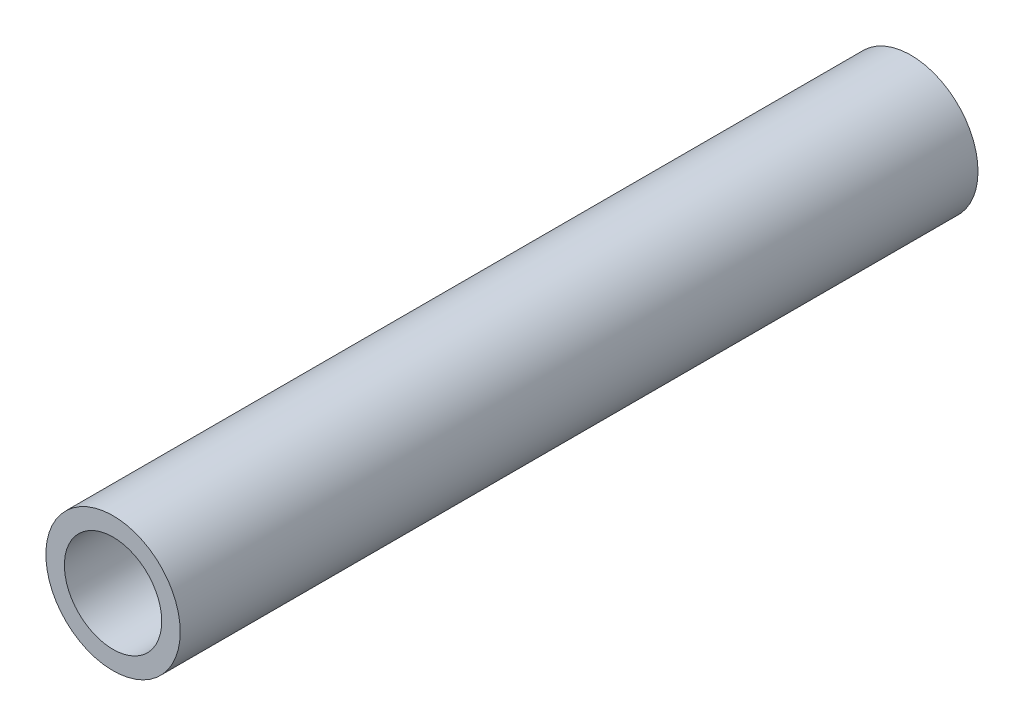
from build123d import *

# Parameters (mm, degrees)
SKETCH1_R           = 10.6934
SKETCH1_R_2         = 7.747
BOSS_EXTRUDE1_DEPTH = 127


with BuildPart() as part:
    # Sketch1 → Boss-Extrude1 (new body)
    with BuildSketch(Plane.XY):
        Circle(SKETCH1_R)
        Circle(SKETCH1_R_2, mode=Mode.SUBTRACT)
    extrude(amount=BOSS_EXTRUDE1_DEPTH)


solid = part.part
